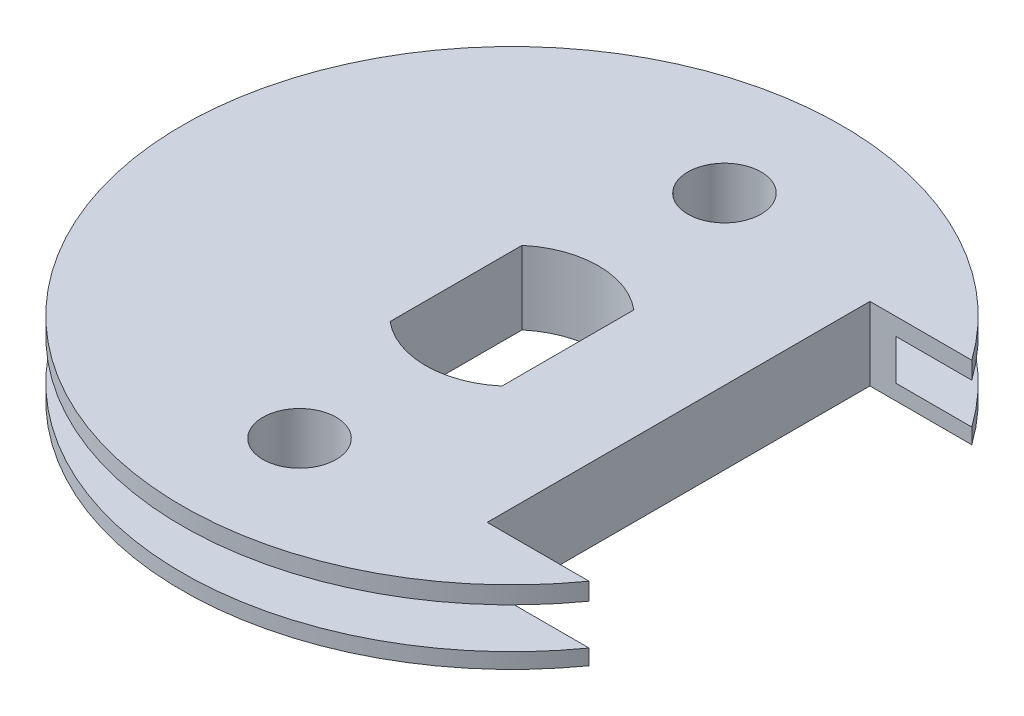
from build123d import *

# Parameters (mm, degrees)
SKETCH_1_R          = 9
EXTRUDE_3_DEPTH     = 2
SKETCH_2_R          = 1
CUT_EXTRUDE_1_DEPTH = 2
CUT_EXTRUDE_2_DEPTH = 4
SKETCH_6_W          = 1.51058073
SKETCH_6_H          = 3.6
EXTRUDE_4_DEPTH     = 2
CUT_EXTRUDE_3_DEPTH = 2


with BuildPart() as part:
    # 草图1 → 凸台-拉伸3 (new body)
    with BuildSketch(Plane(origin=(0, 0, 0), x_dir=(1, 0, 0), z_dir=(0, 1, 0))):
        with Locations(Location((0, 0, 0), (0, 0, 270))):
            Circle(SKETCH_1_R)
        with BuildLine():
            ThreePointArc((1.526302722, -1.8), (2.36, 0), (1.526302722, 1.8))
            Line((1.526302722, 1.8), (-1.526302722, 1.8))
            ThreePointArc((-1.526302722, 1.8), (-2.36, 0), (-1.526302722, -1.8))
            Line((-1.526302722, -1.8), (1.526302722, -1.8))
        make_face(mode=Mode.SUBTRACT)
    extrude(amount=EXTRUDE_3_DEPTH)

    # 草图2 → 切除-拉伸1 (cut)
    with BuildSketch(Plane(origin=(0, 2, 0), x_dir=(1, 0, 0), z_dir=(0, 1, 0))):
        with Locations(Location((0, 5.8, 0), (0, 0, 270))):
            Circle(SKETCH_2_R)
        with Locations(Location((0, -5.8, 0), (0, 0, 90))):
            Circle(SKETCH_2_R)
    extrude(amount=-CUT_EXTRUDE_1_DEPTH, mode=Mode.SUBTRACT)

    # 草图3 → 切除-旋转1 (revolve, cut)
    with BuildSketch(Plane.XY, mode=Mode.PRIVATE) as cut_revolve_1_sk:
        Polygon((9, 1.526508216), (8.095229941, 1.526508216), (7.409057175, 1.526508216), (7.409057175, 0.419519155), (8.095229941, 0.419519155), (9, 0.419519155), align=None)
    revolve(cut_revolve_1_sk.sketch.rotate(Axis((0, 0, 0), (0, 1, 0)), 90), axis=Axis((0, 0, 0), (0, 1, 0)), mode=Mode.SUBTRACT)

    # 草图4 → 切除-拉伸2 (cut)
    with BuildSketch(Plane(origin=(0, 0, 0), x_dir=(1, 0, 0), z_dir=(0, 1, 0))):
        Polygon((8.707482993, 5.224489796), (5.925925926, 5.224489796), (4.547241119, 5.224489796), (4.547241119, -5.224489796), (5.925925926, -5.224489796), (8.707482993, -5.224489796), (10.594104308, -5.224489796), (10.594104308, 5.224489796), align=None)
    extrude(amount=CUT_EXTRUDE_2_DEPTH, mode=Mode.SUBTRACT)

    # 草图6 → 凸台-拉伸4 (add)
    with BuildSketch(Plane(origin=(0, 2, 0), x_dir=(1, 0, 0), z_dir=(0, 1, 0))):
        with Locations((-2.281593087, 0)):
            Rectangle(SKETCH_6_W, SKETCH_6_H)
        with Locations((2.281593087, 0)):
            Rectangle(SKETCH_6_W, SKETCH_6_H)
    extrude(amount=-EXTRUDE_4_DEPTH)

    # 草图5 → 切除-拉伸3 (cut)
    with BuildSketch(Plane(origin=(0, 2, 0), x_dir=(1, 0, 0), z_dir=(0, 1, 0))):
        with BuildLine():
            Line((1.526302722, 1.8), (1.526302722, -1.8))
            ThreePointArc((1.526302722, -1.8), (0, -2.36), (-1.526302722, -1.8))
            Line((-1.526302722, -1.8), (-1.526302722, 1.8))
            ThreePointArc((-1.526302722, 1.8), (0, 2.36), (1.526302722, 1.8))
        make_face()
    extrude(amount=-CUT_EXTRUDE_3_DEPTH, mode=Mode.SUBTRACT)


solid = part.part
